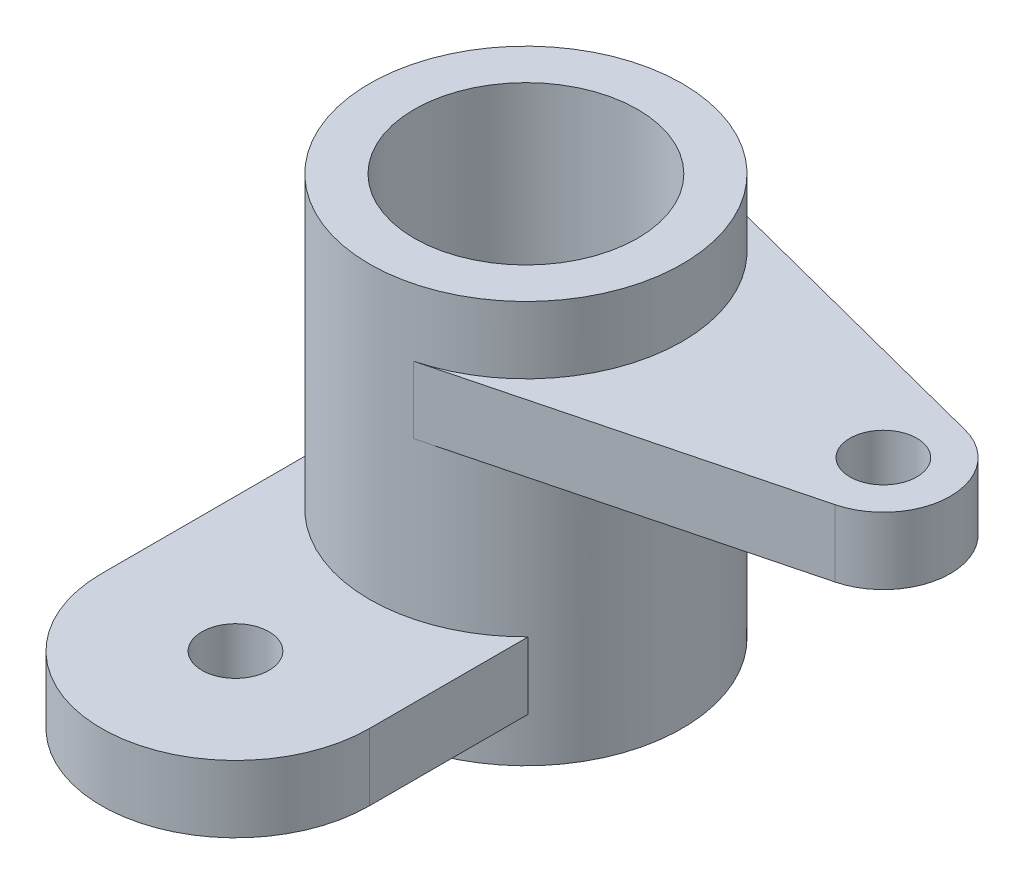
from build123d import *

# Parameters (mm, degrees)
SKETCH1_R           = 25
BOSS_EXTRUDE1_DEPTH = 90
BOSS_EXTRUDE2_START = -65
SKETCH1_3_R         = 7.5
BOSS_EXTRUDE2_DEPTH = 15
BOSS_EXTRUDE3_START = -15
SKETCH1_4_R         = 7.5
BOSS_EXTRUDE3_DEPTH = 15


with BuildPart() as part:
    # Sketch1 → Boss-Extrude1 (new body)
    with BuildSketch(Plane(origin=(0, 0, 0), x_dir=(1, 0, 0), z_dir=(0, 1, 0))):
        with BuildLine():
            ThreePointArc((35, 0), (27.669929526, 21.433035249), (8.75, 33.888604279))
            ThreePointArc((8.75, 33.888604279), (-21.433035249, 27.669929526), (-35, 0))
            ThreePointArc((-35, 0), (-21.433035249, -27.669929526), (8.75, -33.888604279))
            ThreePointArc((8.75, -33.888604279), (17.516451042, -30.301385165), (25, -24.494897428))
            ThreePointArc((25, -24.494897428), (32.403703492, -13.228756555), (35, 0))
        make_face()
        Circle(SKETCH1_R, mode=Mode.SUBTRACT)
    extrude(amount=-BOSS_EXTRUDE1_DEPTH)

    # Sketch1<3> → Boss-Extrude2 (add)
    with BuildSketch(Plane(origin=(0, 0, 0), x_dir=(1, 0, 0), z_dir=(0, 1, 0)).offset(BOSS_EXTRUDE2_START)):
        with BuildLine():
            Line((-35, 0), (-35, -60))
            ThreePointArc((-35, -60), (-5, -90), (25, -60))
            Line((25, -60), (25, -24.494897428))
            ThreePointArc((25, -24.494897428), (-13.228756555, -32.403703492), (-35, 0))
        make_face()
        with Locations((-5, -60)):
            Circle(SKETCH1_3_R, mode=Mode.SUBTRACT)
    extrude(amount=-BOSS_EXTRUDE2_DEPTH)

    # Sketch1<4> → Boss-Extrude3 (add)
    with BuildSketch(Plane(origin=(0, 0, 0), x_dir=(1, 0, 0), z_dir=(0, 1, 0)).offset(BOSS_EXTRUDE3_START)):
        with BuildLine():
            Line((83.75, 14.523687548), (8.75, 33.888604279))
            ThreePointArc((8.75, 33.888604279), (35, 0), (8.75, -33.888604279))
            Line((8.75, -33.888604279), (83.75, -14.523687548))
            ThreePointArc((83.75, -14.523687548), (95, 0), (83.75, 14.523687548))
        make_face()
        with Locations((80, 0)):
            Circle(SKETCH1_4_R, mode=Mode.SUBTRACT)
    extrude(amount=-BOSS_EXTRUDE3_DEPTH)


solid = part.part
